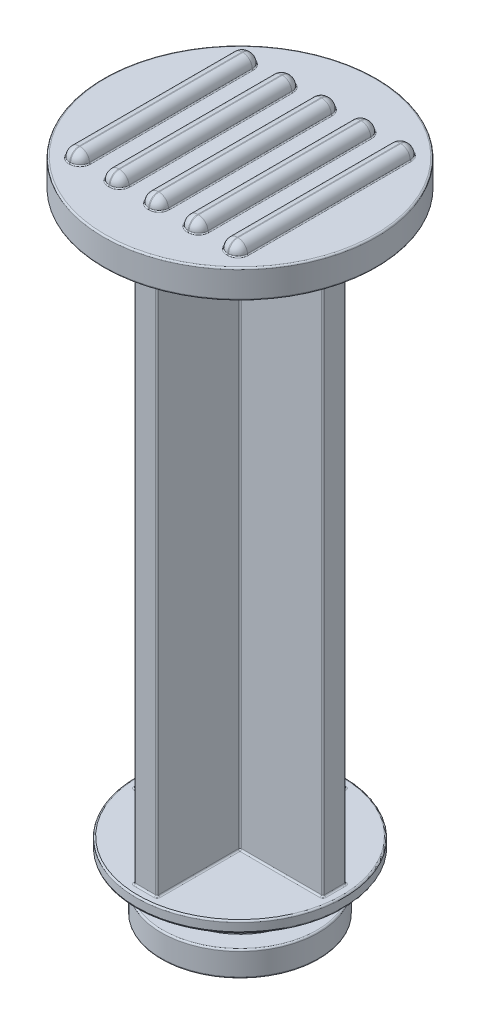
from build123d import *

# Parameters (mm, degrees)
MAIN_BODY_SKETCH_W                         = 18
MAIN_BODY_SKETCH_H                         = 53.33
HALF_MAIN_BODY_EXTRUDE_DEPTH               = 1.105
HALF_MAIN_BODY_COPY_ANGLE                  = 90
BOTTOM_BASE_SKETCH_R                       = 13
BOTTOM_BASE_EXTRUDE_DEPTH                  = 2.71
PROTRUSIONS_SKETCH_W                       = 1.88
PROTRUSIONS_SKETCH_H                       = 17.3
PROTRUSIONS_EXTRUDE_DEPTH                  = 0.97
PROTRUSIONS_SMOOTHING_R                    = 0.9
PROTRUSIONS_SMOOTHING_PLATFORM_R           = 0.1
LPATTERN1_COUNT                            = 3
LPATTERN1_PITCH                            = 3.76
PROTRUSIONS_SMOOTHING_OF_LPATTERN1_R       = 0.9
PROTRUSIONS_SMOOTHING_PLATFORM_OF_LPATTE_R = 0.1
LPATTERN1_COL_COUNT                        = 3
LPATTERN1_COL_PITCH                        = 3.76
PROTRUSIONS_SMOOTHING_OF_LPATTERN1_COL_R   = 0.9
PROTRUSIONS_SMOOTHING_PLATFORM_OF_LP_2_R   = 0.1
TOP_BASE_SKETCH_R                          = 9.875
TOP_BASE_EXTRUDE_DEPTH                     = 1.06
TOP_INTERMEDIATE_SKETCH_R                  = 5.7
TOP_INTERMEDIATE_BASE_EXTRUDE_DEPTH        = 3
OUTER_BASE_SKETCH_R                        = 7.505
OUTER_BASE_EXTRUDE_DEPTH                   = 2.4
SMOOTHING_FILLETS_R                        = 0.15


with BuildPart() as part:
    # Main Body Sketch → Half Main Body Extrude (new, symmetric)
    with BuildSketch(Plane.XY):
        Rectangle(MAIN_BODY_SKETCH_W, MAIN_BODY_SKETCH_H)
    extrude(amount=HALF_MAIN_BODY_EXTRUDE_DEPTH, both=True)


with BuildPart() as body_2:
    # Half Main Body Copy: copy of part
    add(part.part.rotate(Axis((0, 0, 0), (0, 1, 0)), HALF_MAIN_BODY_COPY_ANGLE))


with BuildPart() as part_1:
    add(part.part)

    add(body_2.part)  # Bottom Base Extrude merges body 2
    # Bottom Base Sketch → Bottom Base Extrude (add)
    with BuildSketch(Plane(origin=(0, 26.665, 0), x_dir=(1, 0, 0), z_dir=(0, 1, 0))):
        with Locations(Location((0, 0, 0), (0, 0, 270))):
            Circle(BOTTOM_BASE_SKETCH_R)
    extrude(amount=BOTTOM_BASE_EXTRUDE_DEPTH)

    # Protrusions Sketch → Protrusions Extrude (add)
    with BuildSketch(Plane(origin=(0, 29.375, 0), x_dir=(1, 0, 0), z_dir=(0, 1, 0))):
        Rectangle(PROTRUSIONS_SKETCH_W, PROTRUSIONS_SKETCH_H)
    protrusions_extrude = extrude(amount=PROTRUSIONS_EXTRUDE_DEPTH)

    # Protrusions Smoothing
    protrusions_smoothing_edges = [part_1.edges().sort_by_distance(p)[0] for p in [
        (0, 30.345, -8.65),
        (0.94, 29.86, -8.65),
        (-0.94, 30.345, 0),
        (-0.94, 29.86, -8.65),
        (-0.94, 29.86, 8.65),
        (0.94, 29.86, 8.65),
        (0, 30.345, 8.65),
        (0.94, 30.345, 0),
    ]]
    fillet(protrusions_smoothing_edges, radius=PROTRUSIONS_SMOOTHING_R)

    # Protrusions Smoothing Platform
    protrusions_smoothing_platform_edges = [part_1.edges().sort_by_distance(p)[0] for p in [
        (0, 29.375, 8.65),
        (0, 29.375, -8.65),
        (0.676396103, 29.375, -8.386396103),
        (0.94, 29.375, 0),
        (0.676396103, 29.375, 8.386396103),
        (-0.676396103, 29.375, -8.386396103),
        (-0.676396103, 29.375, 8.386396103),
        (-0.94, 29.375, 0),
    ]]
    fillet(protrusions_smoothing_platform_edges, radius=PROTRUSIONS_SMOOTHING_PLATFORM_R)

    # LPattern1: Protrusions Extrude ×3
    with Locations(*[(i * LPATTERN1_PITCH, 0, 0) for i in range(1, LPATTERN1_COUNT)]):
        add(protrusions_extrude)

    # Protrusions Smoothing of LPattern1
    protrusions_smoothing_of_lpattern1_edges = [part_1.edges().sort_by_distance(p)[0] for p in [
        (3.76, 30.345, -8.65),
        (4.7, 29.86, -8.65),
        (2.82, 30.345, 0),
        (2.82, 29.86, -8.65),
        (2.82, 29.86, 8.65),
        (4.7, 29.86, 8.65),
        (3.76, 30.345, 8.65),
        (4.7, 30.345, 0),
        (7.52, 30.345, -8.65),
        (8.46, 29.86, -8.65),
        (6.58, 30.345, 0),
        (6.58, 29.86, -8.65),
        (6.58, 29.86, 8.65),
        (8.46, 29.86, 8.65),
        (7.52, 30.345, 8.65),
        (8.46, 30.345, 0),
    ]]
    fillet(protrusions_smoothing_of_lpattern1_edges, radius=PROTRUSIONS_SMOOTHING_OF_LPATTERN1_R)

    # Protrusions Smoothing Platform of LPatte
    protrusions_smoothing_platform_of_lpatte_edges = [part_1.edges().sort_by_distance(p)[0] for p in [
        (3.76, 29.375, 8.65),
        (3.76, 29.375, -8.65),
        (4.436396103, 29.375, -8.386396103),
        (4.7, 29.375, 0),
        (4.436396103, 29.375, 8.386396103),
        (3.083603897, 29.375, -8.386396103),
        (3.083603897, 29.375, 8.386396103),
        (2.82, 29.375, 0),
        (7.52, 29.375, 8.65),
        (7.52, 29.375, -8.65),
        (8.196396103, 29.375, -8.386396103),
        (8.46, 29.375, 0),
        (8.196396103, 29.375, 8.386396103),
        (6.843603897, 29.375, -8.386396103),
        (6.843603897, 29.375, 8.386396103),
        (6.58, 29.375, 0),
    ]]
    fillet(protrusions_smoothing_platform_of_lpatte_edges, radius=PROTRUSIONS_SMOOTHING_PLATFORM_OF_LPATTE_R)

    # LPattern1 col: Protrusions Extrude ×3
    with Locations(*[(-i * LPATTERN1_COL_PITCH, 0, 0) for i in range(1, LPATTERN1_COL_COUNT)]):
        add(protrusions_extrude)

    # Protrusions Smoothing of LPattern1 col
    protrusions_smoothing_of_lpattern1_col_edges = [part_1.edges().sort_by_distance(p)[0] for p in [
        (-3.76, 30.345, -8.65),
        (-2.82, 29.86, -8.65),
        (-4.7, 30.345, 0),
        (-4.7, 29.86, -8.65),
        (-4.7, 29.86, 8.65),
        (-2.82, 29.86, 8.65),
        (-3.76, 30.345, 8.65),
        (-2.82, 30.345, 0),
        (-7.52, 30.345, -8.65),
        (-6.58, 29.86, -8.65),
        (-8.46, 30.345, 0),
        (-8.46, 29.86, -8.65),
        (-8.46, 29.86, 8.65),
        (-6.58, 29.86, 8.65),
        (-7.52, 30.345, 8.65),
        (-6.58, 30.345, 0),
    ]]
    fillet(protrusions_smoothing_of_lpattern1_col_edges, radius=PROTRUSIONS_SMOOTHING_OF_LPATTERN1_COL_R)

    # Protrusions Smoothing Platform of LP 2
    protrusions_smoothing_platform_of_lp_2_edges = [part_1.edges().sort_by_distance(p)[0] for p in [
        (-3.76, 29.375, 8.65),
        (-3.76, 29.375, -8.65),
        (-3.083603897, 29.375, -8.386396103),
        (-2.82, 29.375, 0),
        (-3.083603897, 29.375, 8.386396103),
        (-4.436396103, 29.375, -8.386396103),
        (-4.436396103, 29.375, 8.386396103),
        (-4.7, 29.375, 0),
        (-7.52, 29.375, 8.65),
        (-7.52, 29.375, -8.65),
        (-6.843603897, 29.375, -8.386396103),
        (-6.58, 29.375, 0),
        (-6.843603897, 29.375, 8.386396103),
        (-8.196396103, 29.375, -8.386396103),
        (-8.196396103, 29.375, 8.386396103),
        (-8.46, 29.375, 0),
    ]]
    fillet(protrusions_smoothing_platform_of_lp_2_edges, radius=PROTRUSIONS_SMOOTHING_PLATFORM_OF_LP_2_R)

    # Top Base Sketch → Top Base Extrude (add)
    with BuildSketch(Plane(origin=(0, -26.665, 0), x_dir=(-1, 0, 0), z_dir=(0, -1, 0))):
        with Locations(Location((0, 0, 0), (0, 0, 90))):
            Circle(TOP_BASE_SKETCH_R)
    extrude(amount=TOP_BASE_EXTRUDE_DEPTH)

    # Top Intermediate Sketch → Top Intermediate Base Extrude (add)
    with BuildSketch(Plane(origin=(0, -27.725, 0), x_dir=(-1, 0, 0), z_dir=(0, -1, 0))):
        with Locations(Location((0, 0, 0), (0, 0, 90))):
            Circle(TOP_INTERMEDIATE_SKETCH_R)
    extrude(amount=TOP_INTERMEDIATE_BASE_EXTRUDE_DEPTH)

    # Outer Base Sketch → Outer Base Extrude (add)
    with BuildSketch(Plane(origin=(0, -30.725, 0), x_dir=(-1, 0, 0), z_dir=(0, -1, 0))):
        with Locations(Location((0, 0, 0), (0, 0, 90))):
            Circle(OUTER_BASE_SKETCH_R)
    extrude(amount=OUTER_BASE_EXTRUDE_DEPTH)

    # Smoothing Fillets
    smoothing_fillets_edges = [part_1.edges().sort_by_distance(p)[0] for p in [
        (9, 0, 1.105),
        (0, 26.665, -13),
        (0, 29.375, -13),
        (-5.0525, -26.665, 1.105),
        (5.0525, 26.665, -1.105),
        (5.0525, 26.665, 1.105),
        (-1.105, 26.665, -5.0525),
        (1.105, 26.665, -5.0525),
        (5.0525, -26.665, -1.105),
        (5.0525, -26.665, 1.105),
        (0, -26.665, 9.875),
        (0, -27.725, 9.875),
        (-1.105, -26.665, 5.0525),
        (0, -26.665, 9),
        (0, -30.725, 7.505),
        (1.105, 26.665, 5.0525),
        (0, -33.125, 7.505),
        (1.105, -26.665, 5.0525),
        (1.105, 0, 1.105),
        (1.105, 0, -1.105),
        (-1.105, 0, 9),
        (-1.105, 26.665, 5.0525),
        (-1.105, 0, 1.105),
        (1.105, 0, 9),
        (0, 26.665, 9),
        (-1.105, -26.665, -5.0525),
        (-1.105, 0, -9),
        (0, -26.665, -9),
        (0, 26.665, -9),
        (1.105, -26.665, -5.0525),
        (1.105, 0, -9),
        (-1.105, 0, -1.105),
        (-9, 0, 1.105),
        (-5.0525, -26.665, -1.105),
        (9, 0, -1.105),
        (-5.0525, 26.665, -1.105),
        (-9, 0, -1.105),
        (-9, -26.665, 0),
        (9, -26.665, 0),
        (9, 26.665, 0),
        (-9, 26.665, 0),
        (-5.0525, 26.665, 1.105),
    ]]
    fillet(smoothing_fillets_edges, radius=SMOOTHING_FILLETS_R)


solid = part_1.part
